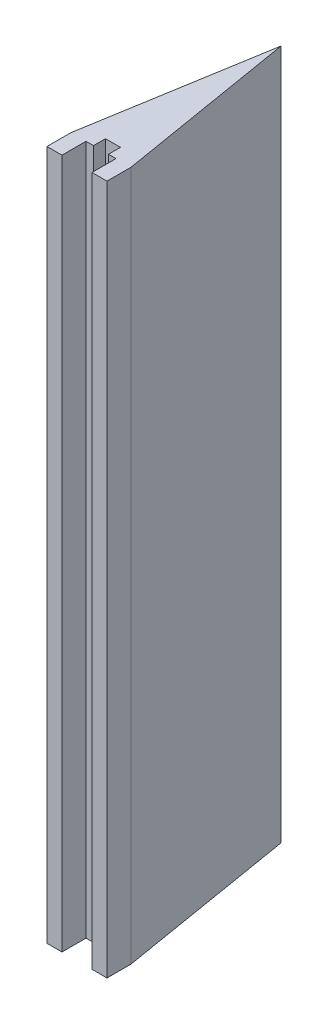
from build123d import *

# Parameters (mm, degrees)
BOSS_EXTRUDE1_DEPTH = 146.05


with BuildPart() as part:
    # Sketch1 → Boss-Extrude1 (new body)
    with BuildSketch(Plane(origin=(0, 0, 0), x_dir=(1, 0, 0), z_dir=(0, 1, 0))):
        Polygon((0, 38.1), (-6.35, 0), (-6.35, -5.08), (-3.175, -5.08), (-3.175, 0), (-1.5875, 0), (-1.5875, 2.54), (1.5875, 2.54), (1.5875, 0), (3.175, 0), (3.175, -5.08), (6.35, -5.08), (6.35, 0), align=None)
    extrude(amount=BOSS_EXTRUDE1_DEPTH)


solid = part.part
